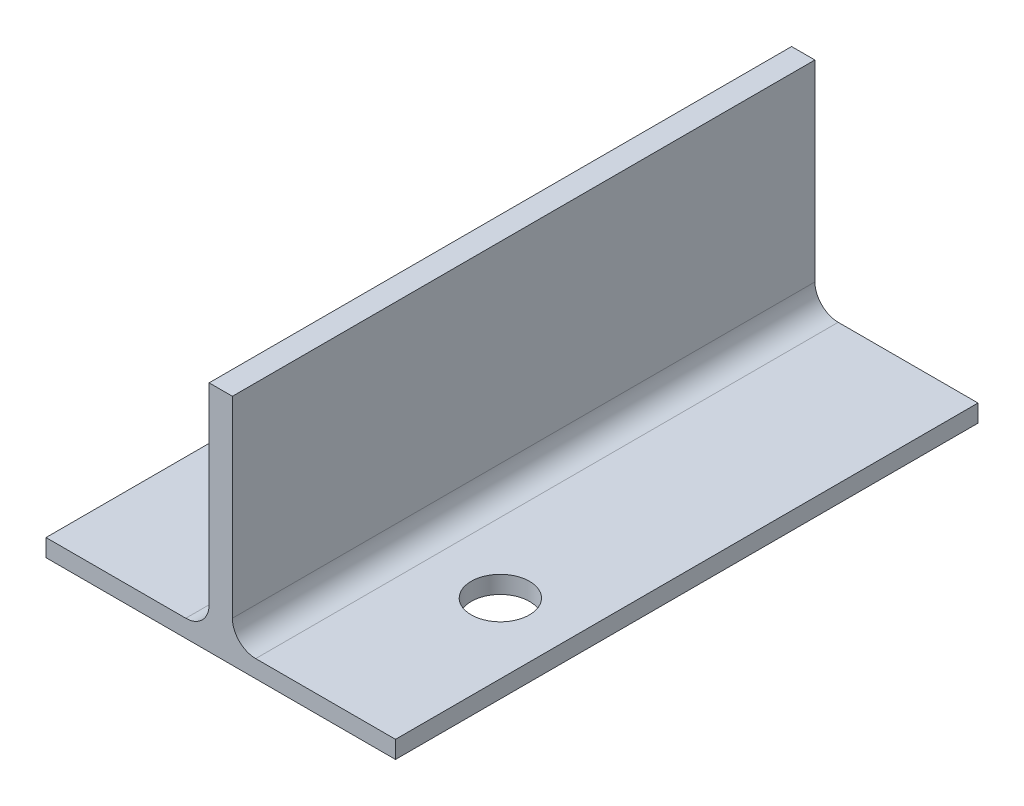
from build123d import *

# Parameters (mm, degrees)
EXTRUDE_3_DEPTH     = 25
SKETCH_5_R          = 2.5
CUT_EXTRUDE_1_DEPTH = 35.528973341


with BuildPart() as part:
    # 草图3 → 凸台-拉伸3 (new, symmetric)
    with BuildSketch(Plane.XY):
        with BuildLine():
            Line((15, 1.5), (-15, 1.5))
            Line((-15, 1.5), (-15, 3))
            Line((-15, 3), (-3, 3))
            ThreePointArc((-3, 3), (-1.585786438, 3.585786438), (-1, 5))
            Line((-1, 5), (-1, 21.5))
            Line((-1, 21.5), (1, 21.5))
            Line((1, 21.5), (1, 5))
            ThreePointArc((1, 5), (1.585786438, 3.585786438), (3, 3))
            Line((3, 3), (15, 3))
            Line((15, 3), (15, 1.5))
        make_face()
    extrude(amount=EXTRUDE_3_DEPTH, both=True)

    # 草图5 → 切除-拉伸1 (cut, through all)
    with BuildSketch(Plane(origin=(0, 3, 0), x_dir=(1, 0, 0), z_dir=(0, 1, 0))):
        with Locations(Location((9, -10, 0), (0, 0, 270))):
            Circle(SKETCH_5_R)
    cut_extrude_1 = extrude(amount=-CUT_EXTRUDE_1_DEPTH, mode=Mode.SUBTRACT)

    # 镜向1: 切除-拉伸1 across plane
    add(cut_extrude_1.mirror(Plane(origin=(0, 0, 0), x_dir=(0, 0, 1), z_dir=(1, 0, 0))), mode=Mode.SUBTRACT)


solid = part.part
